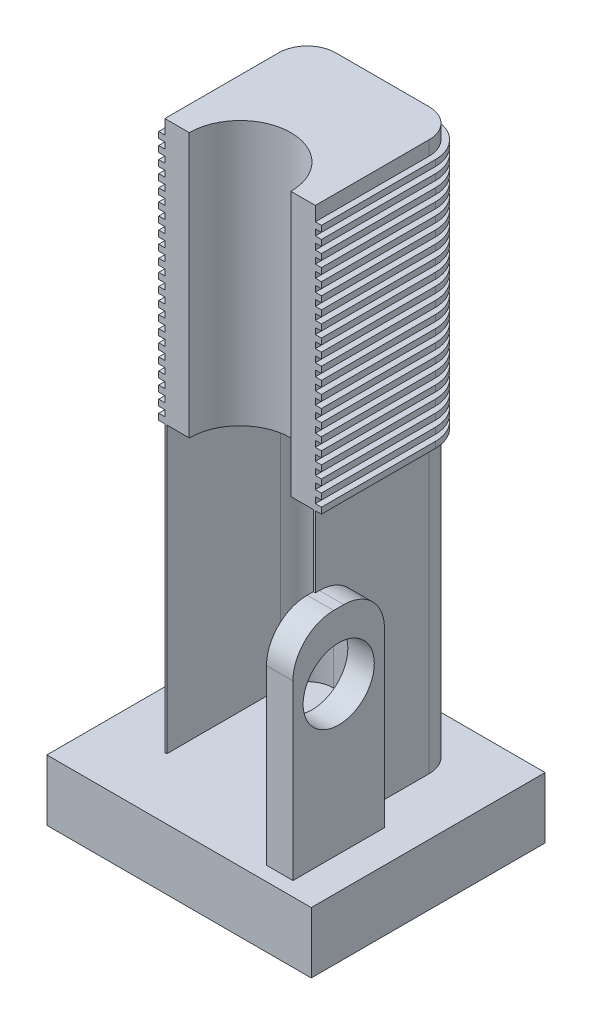
from build123d import *

# Parameters (mm, degrees)
BOSS_EXTRUDE1_DEPTH      = 90
BOSS_EXTRUDE1_DEPTH_BACK = 40
BOSS_EXTRUDE2_DEPTH      = 3
LPATTERN1_COUNT          = 21
LPATTERN1_PITCH          = 6
BOSS_EXTRUDE3_START      = -180
BOSS_EXTRUDE3_DEPTH      = 180
BOSS_EXTRUDE4_DEPTH      = 30
SKETCH10_W               = 13
SKETCH10_H               = 45
BOSS_EXTRUDE6_DEPTH      = 105
FILLET1_R                = 20
CUT_EXTRUDE1_REACH       = 255.616
SKETCH11_R               = 17.5


with BuildPart() as part:
    # Sketch1 → Boss-Extrude1 (new, two sides: drawn at the far end of the back side and taken through both)
    with BuildSketch(Plane(origin=(0, 0, 0), x_dir=(1, 0, 0), z_dir=(0, 1, 0)).offset(-BOSS_EXTRUDE1_DEPTH_BACK)):
        with BuildLine():
            Line((25, 0), (37, 0))
            Line((37, 0), (37, 56))
            ThreePointArc((37, 56), (32.899494937, 65.899494937), (23, 70))
            Line((23, 70), (-23, 70))
            ThreePointArc((-23, 70), (-32.899494937, 65.899494937), (-37, 56))
            Line((-37, 56), (-37, 0))
            Line((-37, 0), (-25, 0))
            ThreePointArc((-25, 0), (0, 25), (25, 0))
        make_face()
    extrude(amount=BOSS_EXTRUDE1_DEPTH + BOSS_EXTRUDE1_DEPTH_BACK)

    # Sketch3 → Boss-Extrude2 (add)
    with BuildSketch(Plane.XZ.offset(40)):
        with BuildLine():
            ThreePointArc((23, -73), (35.02081528, -68.02081528), (40, -56))
            Line((40, -56), (40, 0))
            Line((40, 0), (37, 0))
            Line((37, 0), (37, -56))
            ThreePointArc((37, -56), (32.899494937, -65.899494937), (23, -70))
            Line((23, -70), (-23, -70))
            ThreePointArc((-23, -70), (-32.899494937, -65.899494937), (-37, -56))
            Line((-37, -56), (-37, 0))
            Line((-37, 0), (-40, 0))
            Line((-40, 0), (-40, -56))
            ThreePointArc((-40, -56), (-35.02081528, -68.02081528), (-23, -73))
            Line((-23, -73), (23, -73))
        make_face()
    boss_extrude2 = extrude(amount=-BOSS_EXTRUDE2_DEPTH)

    # LPattern1: Boss-Extrude2 ×21
    with Locations(*[(0, i * LPATTERN1_PITCH, 0) for i in range(1, LPATTERN1_COUNT)]):
        add(boss_extrude2)

    # Sketch6 → Boss-Extrude3 (add)
    with BuildSketch(Plane(origin=(0, 0, 0), x_dir=(1, 0, 0), z_dir=(0, 1, 0)).offset(BOSS_EXTRUDE3_START)):
        with BuildLine():
            Line((-37, 0), (-37, 56))
            ThreePointArc((-37, 56), (-32.899494937, 65.899494937), (-23, 70))
            Line((-23, 70), (23, 70))
            ThreePointArc((23, 70), (32.899494937, 65.899494937), (37, 56))
            Line((37, 56), (37, 0))
            Line((37, 0), (36, 0))
            Line((36, 0), (36, 56))
            ThreePointArc((36, 56), (32.192388155, 65.192388155), (23, 69))
            Line((23, 69), (-23, 69))
            ThreePointArc((-23, 69), (-32.192388155, 65.192388155), (-36, 56))
            Line((-36, 56), (-36, 0))
            Line((-36, 0), (-37, 0))
        make_face()
    extrude(amount=BOSS_EXTRUDE3_DEPTH)

    # Sketch8 → Boss-Extrude4 (add)
    with BuildSketch(Plane.XZ.offset(180)):
        Polygon((-65, 0), (-65, -85), (65, -85), (65, 0), (65, 30), (-65, 30), align=None)
    extrude(amount=BOSS_EXTRUDE4_DEPTH)

    # Sketch10 → Boss-Extrude6 (add)
    with BuildSketch(Plane(origin=(0, -180, 0), x_dir=(1, 0, 0), z_dir=(0, 1, 0))):
        with Locations((42.5, -0.5)):
            Rectangle(SKETCH10_W, SKETCH10_H)
    extrude(amount=BOSS_EXTRUDE6_DEPTH)

    # Fillet1
    fillet1_edges = [part.edges().sort_by_distance(p)[0] for p in [
        (42.5, -75, 23),
        (43, -75, -22),
    ]]
    fillet(fillet1_edges, radius=FILLET1_R)

    # Sketch11 → Cut-Extrude1 (cut, up to next)
    with BuildSketch(Plane(origin=(49, 0, 0), x_dir=(0, 0, -1), z_dir=(1, 0, 0)), mode=Mode.PRIVATE) as cut_extrude1_sk1:
        with Locations((-0.5, -107.5)):
            Circle(SKETCH11_R)
    cut_extrude1_tool1 = extrude(cut_extrude1_sk1.sketch, amount=-CUT_EXTRUDE1_REACH, mode=Mode.PRIVATE) & part.part
    add(cut_extrude1_tool1.solids().sort_by_distance((49, -107.5, 0.5))[0], mode=Mode.SUBTRACT)


solid = part.part
